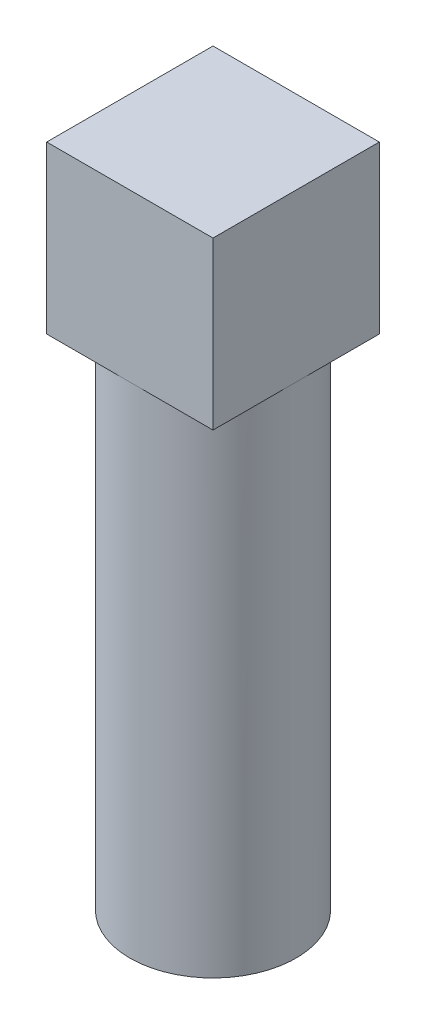
from build123d import *

# Parameters (mm, degrees)
ESBO_O1_R                = 0.5
RESSALTO_EXTRUS_O1_DEPTH = 4
ESBO_O2_W                = 1
ESBO_O2_H                = 1
RESSALTO_EXTRUS_O2_DEPTH = 1


with BuildPart() as part:
    # Esboço1 → Ressalto-extrusão1 (new body)
    with BuildSketch(Plane(origin=(0, 0, 0), x_dir=(1, 0, 0), z_dir=(0, 1, 0))):
        with Locations(Location((0, 0, 0), (0, 0, 270))):
            Circle(ESBO_O1_R)
    extrude(amount=RESSALTO_EXTRUS_O1_DEPTH)

    # Esboço2 → Ressalto-extrusão2 (add)
    with BuildSketch(Plane(origin=(0, 4, 0), x_dir=(1, 0, 0), z_dir=(0, 1, 0))):
        Rectangle(ESBO_O2_W, ESBO_O2_H)
    extrude(amount=-RESSALTO_EXTRUS_O2_DEPTH)


solid = part.part
